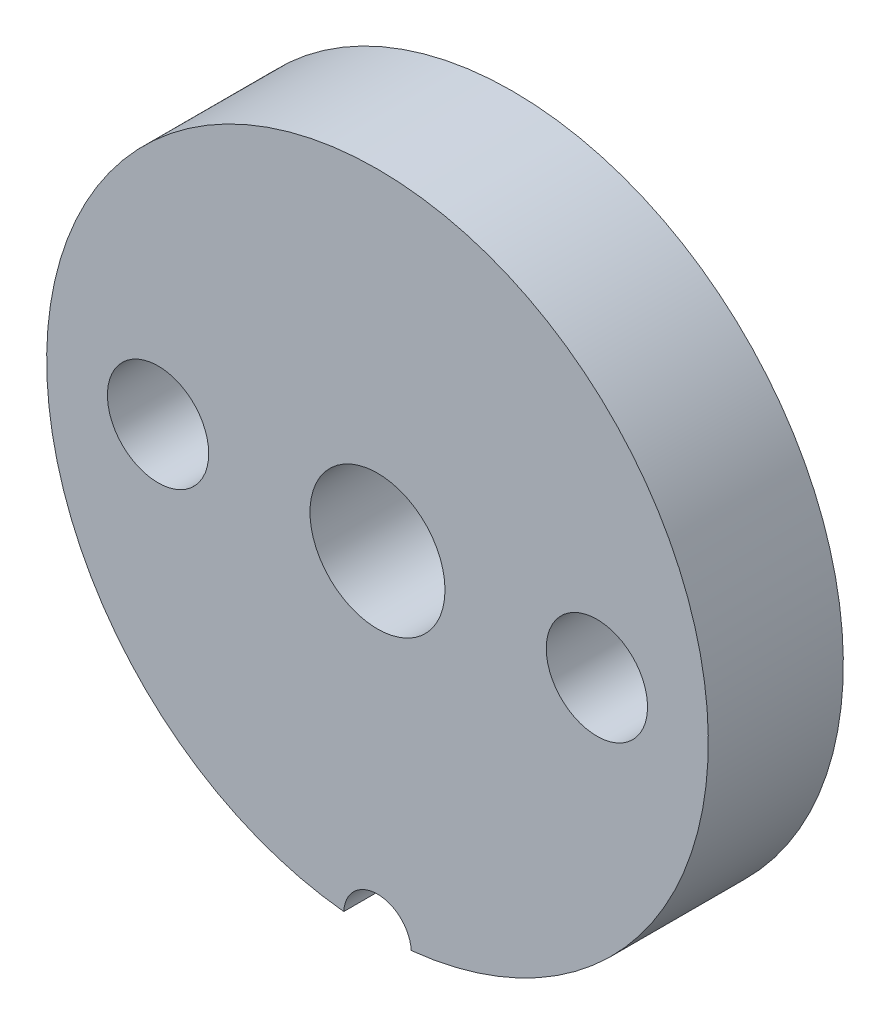
from build123d import *

# Parameters (mm, degrees)
SKETCH_1_R          = 9.8
SKETCH_1_R_2        = 1.5
SKETCH_1_R_3        = 2
EXTRUDE_1_DEPTH     = 4
SKETCH_2_R          = 1
CUT_EXTRUDE_1_DEPTH = 10


with BuildPart() as part:
    # 草图1 → 凸台-拉伸1 (new body)
    with BuildSketch(Plane.XY):
        with Locations((0.783567134, -3.891783567)):
            Circle(SKETCH_1_R)
        with Locations((-5.716432866, -3.891783567)):
            Circle(SKETCH_1_R_2, mode=Mode.SUBTRACT)
        with Locations(Location((7.283567134, -3.891783567, 0), (0, 0, 180))):
            Circle(SKETCH_1_R_2, mode=Mode.SUBTRACT)
        with Locations((0.783567134, -3.891783567)):
            Circle(SKETCH_1_R_3, mode=Mode.SUBTRACT)
    extrude(amount=EXTRUDE_1_DEPTH)

    # 草图2 → 切除-拉伸1 (cut)
    with BuildSketch(Plane.XY.offset(4)):
        with Locations((0.783567134, -13.691783567)):
            Circle(SKETCH_2_R)
    extrude(amount=-CUT_EXTRUDE_1_DEPTH, mode=Mode.SUBTRACT)


solid = part.part
